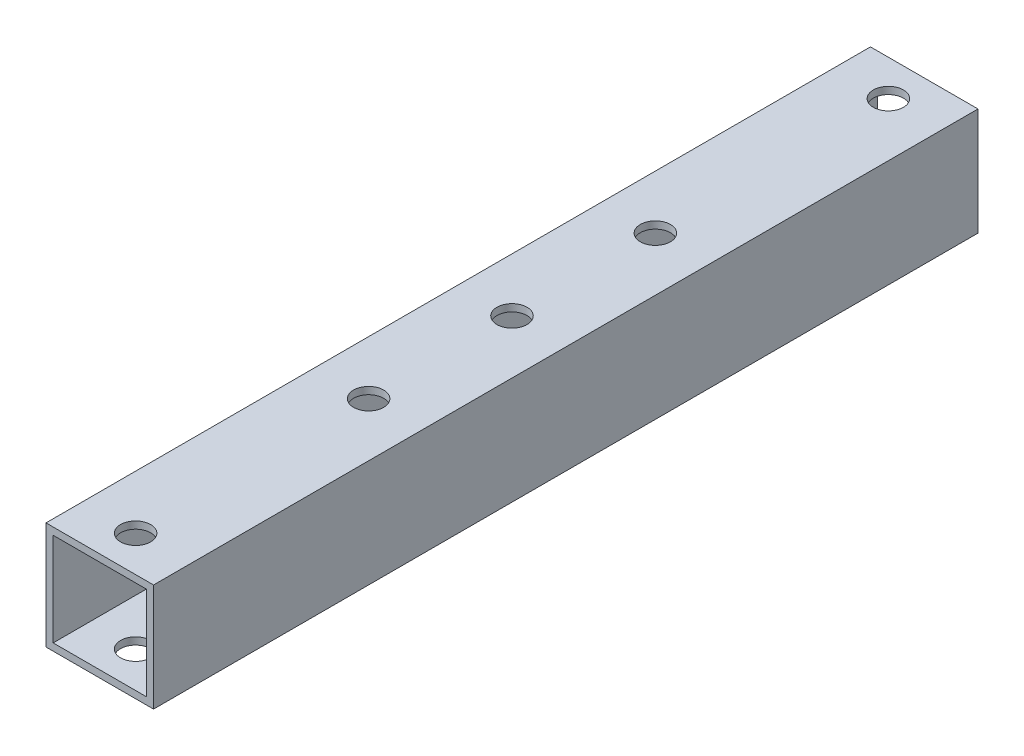
from build123d import *

# Parameters (mm, degrees)
SKETCH_1_W          = 15
SKETCH_1_H          = 15
SKETCH_1_W_2        = 13
SKETCH_1_H_2        = 13
EXTRUDE_1_DEPTH     = 115
CUT_EXTRUDE_1_DEPTH = 117.216392992


with BuildPart() as part:
    # ｽｹｯﾁ1 → 押し出し-薄板1 (new body)
    with BuildSketch(Plane.XY):
        Rectangle(SKETCH_1_W, SKETCH_1_H)
        Rectangle(SKETCH_1_W_2, SKETCH_1_H_2, mode=Mode.SUBTRACT)
    extrude(amount=EXTRUDE_1_DEPTH)

    # ｽｹｯﾁ2 → ｶｯﾄ - 押し出し1 (cut, through all)
    with BuildSketch(Plane(origin=(0, 7.5, 0), x_dir=(1, 0, 0), z_dir=(0, 1, 0))):
        with BuildLine():
            ThreePointArc((2.1, -110), (1.48492424, -108.51507576), (0, -107.9))
            Line((0, -107.9), (0, -112.1))
            ThreePointArc((0, -112.1), (1.48492424, -111.48492424), (2.1, -110))
        make_face()
        with BuildLine():
            Line((0, -112.1), (0, -107.9))
            ThreePointArc((0, -107.9), (-2.1, -110), (0, -112.1))
        make_face()
        with BuildLine():
            ThreePointArc((2.1, -77.5), (1.48492424, -76.01507576), (0, -75.4))
            Line((0, -75.4), (0, -79.6))
            ThreePointArc((0, -79.6), (1.48492424, -78.98492424), (2.1, -77.5))
        make_face()
        with BuildLine():
            Line((0, -79.6), (0, -75.4))
            ThreePointArc((0, -75.4), (-2.1, -77.5), (0, -79.6))
        make_face()
        with BuildLine():
            Line((0, -57.5), (0, -55.4))
            ThreePointArc((0, -55.4), (-2.1, -57.5), (0, -59.6))
            Line((0, -59.6), (0, -57.5))
        make_face()
        with BuildLine():
            ThreePointArc((2.1, -57.5), (1.48492424, -56.01507576), (0, -55.4))
            Line((0, -55.4), (0, -57.5))
            Line((0, -57.5), (2.1, -57.5))
        make_face()
        with BuildLine():
            Line((2.1, -57.5), (0, -57.5))
            Line((0, -57.5), (0, -59.6))
            ThreePointArc((0, -59.6), (1.48492424, -58.98492424), (2.1, -57.5))
        make_face()
        with BuildLine():
            ThreePointArc((2.1, -37.5), (1.48492424, -36.01507576), (0, -35.4))
            Line((0, -35.4), (0, -39.6))
            ThreePointArc((0, -39.6), (1.48492424, -38.98492424), (2.1, -37.5))
        make_face()
        with BuildLine():
            Line((0, -39.6), (0, -35.4))
            ThreePointArc((0, -35.4), (-2.1, -37.5), (0, -39.6))
        make_face()
        with BuildLine():
            ThreePointArc((2.1, -5), (1.48492424, -3.51507576), (0, -2.9))
            Line((0, -2.9), (0, -7.1))
            ThreePointArc((0, -7.1), (1.48492424, -6.48492424), (2.1, -5))
        make_face()
        with BuildLine():
            Line((0, -7.1), (0, -2.9))
            ThreePointArc((0, -2.9), (-2.1, -5), (0, -7.1))
        make_face()
    extrude(amount=-CUT_EXTRUDE_1_DEPTH, mode=Mode.SUBTRACT)


solid = part.part
